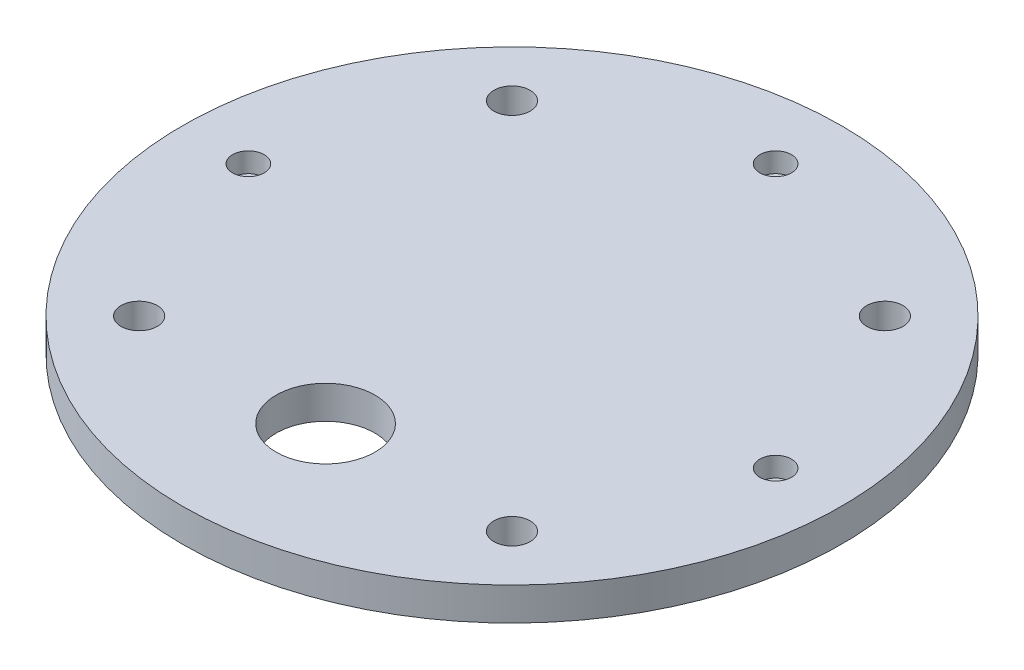
from build123d import *

# Parameters (mm, degrees)
SKETCH_1_R          = 50
EXTRUDE_1_DEPTH     = 5
SKETCH_5_R          = 2.75
CUT_EXTRUDE_4_DEPTH = 24
SKETCH_6_R          = 7.5
CUT_EXTRUDE_5_DEPTH = 24
SKETCH_7_R          = 2.4
CUT_EXTRUDE_6_DEPTH = 3


with BuildPart() as part:
    # 草图1 → 凸台-拉伸1 (new body)
    with BuildSketch(Plane(origin=(0, 0, 0), x_dir=(1, 0, 0), z_dir=(0, 1, 0))):
        with Locations(Location((0, 0, 0), (0, 0, 270))):
            Circle(SKETCH_1_R)
    extrude(amount=-EXTRUDE_1_DEPTH)

    # 草图5 → 切除-拉伸4 (cut)
    with BuildSketch(Plane(origin=(0, 0, 0), x_dir=(1, 0, 0), z_dir=(0, 1, 0))):
        with Locations(Location((28.284271247, 28.284271247, 0), (0, 0, 270))):
            Circle(SKETCH_5_R)
        with Locations(Location((28.284271247, -28.284271247, 0), (0, 0, 270))):
            Circle(SKETCH_5_R)
        with Locations(Location((-28.284271247, -28.284271247, 0), (0, 0, 270))):
            Circle(SKETCH_5_R)
        with Locations(Location((-28.284271247, 28.284271247, 0), (0, 0, 270))):
            Circle(SKETCH_5_R)
    extrude(amount=-CUT_EXTRUDE_4_DEPTH, mode=Mode.SUBTRACT)

    # 草图6 → 切除-拉伸5 (cut)
    with BuildSketch(Plane(origin=(0, 0, 0), x_dir=(1, 0, 0), z_dir=(0, 1, 0))):
        with Locations(Location((0, -28.284271247, 0), (0, 0, 270))):
            Circle(SKETCH_6_R)
    extrude(amount=-CUT_EXTRUDE_5_DEPTH, mode=Mode.SUBTRACT)

    # 草图7 → 切除-拉伸6 (cut)
    with BuildSketch(Plane(origin=(0, 0, 0), x_dir=(1, 0, 0), z_dir=(0, 1, 0))):
        with Locations(Location((40, 0, 0), (0, 0, 270))):
            Circle(SKETCH_7_R)
        with Locations(Location((0, 40, 0), (0, 0, 270))):
            Circle(SKETCH_7_R)
        with Locations(Location((-40, 0, 0), (0, 0, 270))):
            Circle(SKETCH_7_R)
    extrude(amount=-CUT_EXTRUDE_6_DEPTH, mode=Mode.SUBTRACT)


solid = part.part
